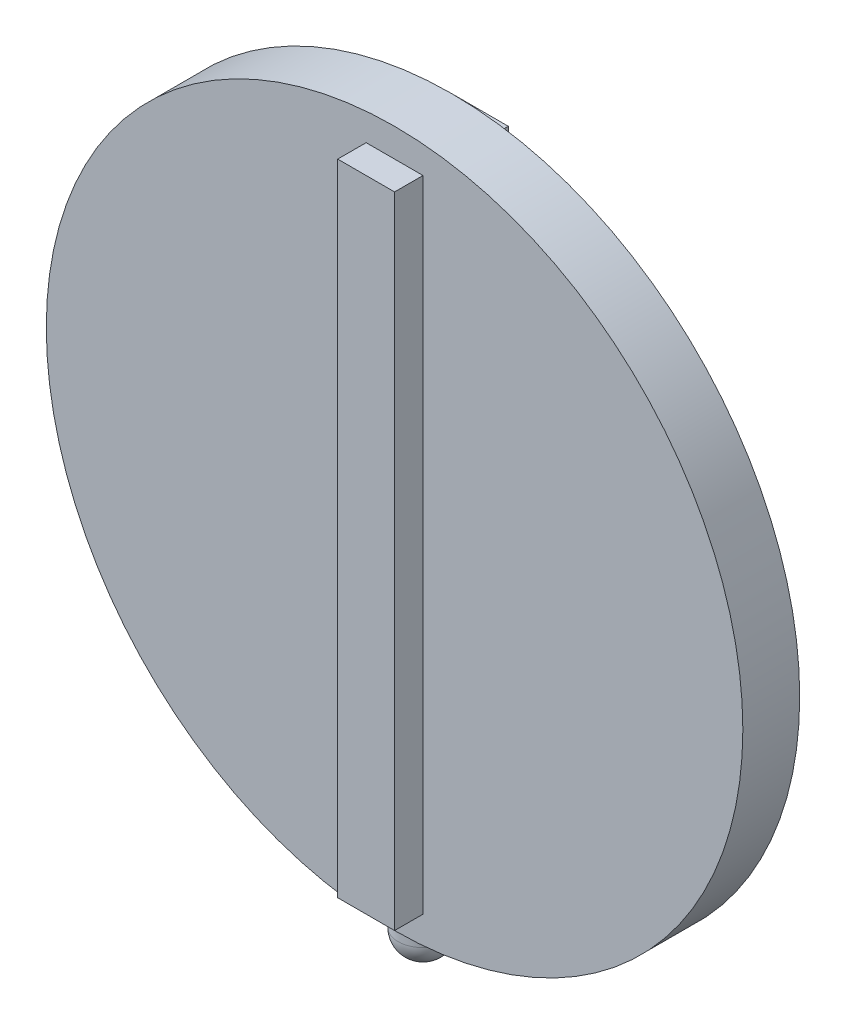
from build123d import *

# Parameters (mm, degrees)
SKETCH_1_R      = 24.5
EXTRUDE_1_DEPTH = 4
SKETCH_2_W      = 4
SKETCH_2_H      = 45
EXTRUDE_2_DEPTH = 2
SKETCH_3_R      = 1.75
EXTRUDE_3_DEPTH = 3
FILLET_2_R      = 1.7


with BuildPart() as part:
    # 草图1 → 凸台-拉伸1 (new body)
    with BuildSketch(Plane.XY):
        Circle(SKETCH_1_R)
    extrude(amount=EXTRUDE_1_DEPTH)

    # 草图2 → 凸台-拉伸2 (add)
    with BuildSketch(Plane.XY.offset(4)):
        Rectangle(SKETCH_2_W, SKETCH_2_H)
    extrude_2 = extrude(amount=EXTRUDE_2_DEPTH)

    # 镜向1: 凸台-拉伸2 across plane
    add(extrude_2.mirror(Plane.XY.offset(2)))

    # 草图3 → 凸台-拉伸3 (add)
    with BuildSketch(Plane(origin=(0, -24, 0), x_dir=(-1, 0, 0), z_dir=(0, -1, 0))):
        with Locations(Location((0, -2, 0), (0, 0, 270))):
            Circle(SKETCH_3_R)
    extrude(amount=EXTRUDE_3_DEPTH)

    # 圆角2
    fillet_2_edges = [part.edges().sort_by_distance(p)[0] for p in [
        (0, -27, 0.25),
    ]]
    fillet(fillet_2_edges, radius=FILLET_2_R)


solid = part.part
